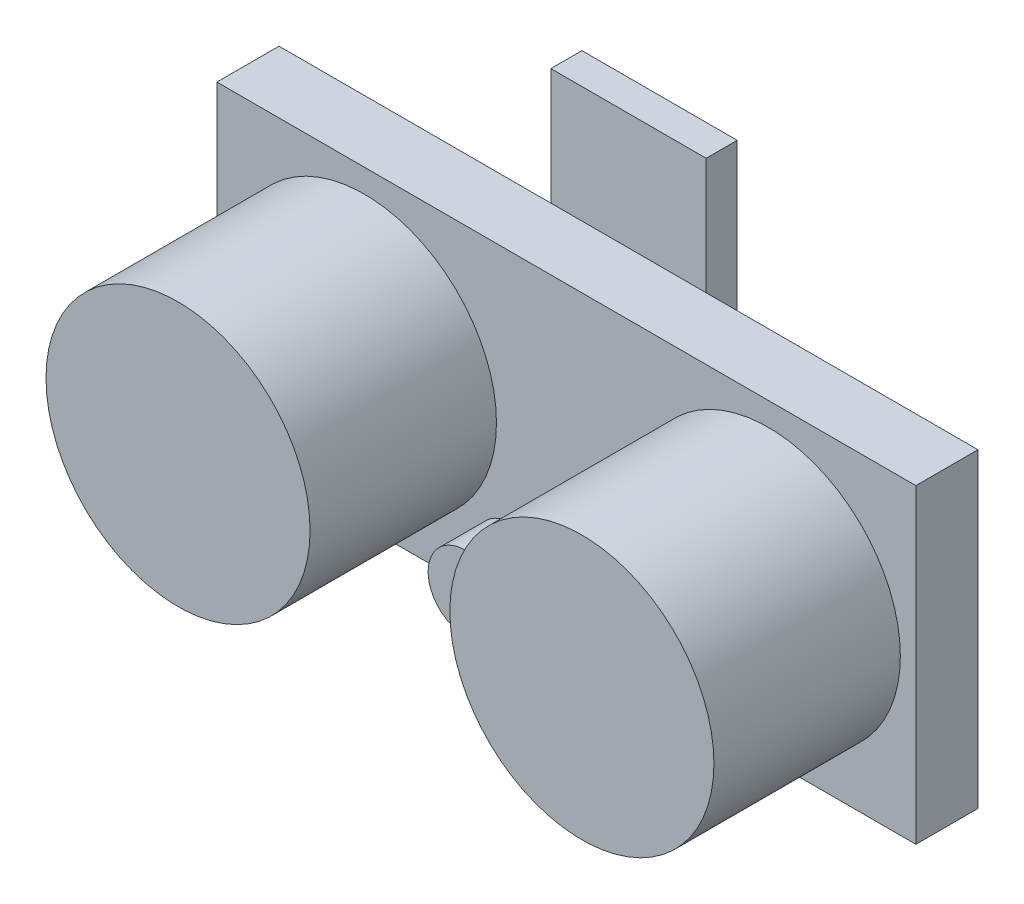
from build123d import *

# Parameters (mm, degrees)
SKETCH1_W           = 45
SKETCH1_H           = 20
BOSS_EXTRUDE1_DEPTH = 4
SKETCH2_W           = 10
SKETCH2_H           = 10
BOSS_EXTRUDE2_DEPTH = 2
SKETCH3_R           = 8.5
BOSS_EXTRUDE3_DEPTH = 12
BOSS_EXTRUDE4_DEPTH = 3


with BuildPart() as part:
    # Sketch1 → Boss-Extrude1 (new body)
    with BuildSketch(Plane.XY):
        Rectangle(SKETCH1_W, SKETCH1_H)
    extrude(amount=BOSS_EXTRUDE1_DEPTH)

    # Sketch2 → Boss-Extrude2 (add)
    with BuildSketch(Plane(origin=(0, 0, 0), x_dir=(-1, 0, 0), z_dir=(0, 0, -1))):
        with Locations((0, 12.5)):
            Rectangle(SKETCH2_W, SKETCH2_H)
    extrude(amount=BOSS_EXTRUDE2_DEPTH)

    # Sketch3 → Boss-Extrude3 (add)
    with BuildSketch(Plane.XY.offset(4)):
        with Locations((-13, 0)):
            Circle(SKETCH3_R)
        with Locations(Location((13, 0, 0), (0, 0, 180))):
            Circle(SKETCH3_R)
    extrude(amount=BOSS_EXTRUDE3_DEPTH)

    # Sketch4 → Boss-Extrude4 (add)
    with BuildSketch(Plane.XY.offset(4)):
        with BuildLine():
            Line((3.5, -9.9), (-3.5, -9.9))
            ThreePointArc((-3.5, -9.9), (-5.9, -7.5), (-3.5, -5.1))
            Line((-3.5, -5.1), (3.5, -5.1))
            ThreePointArc((3.5, -5.1), (5.9, -7.5), (3.5, -9.9))
        make_face()
    extrude(amount=BOSS_EXTRUDE4_DEPTH)


solid = part.part
